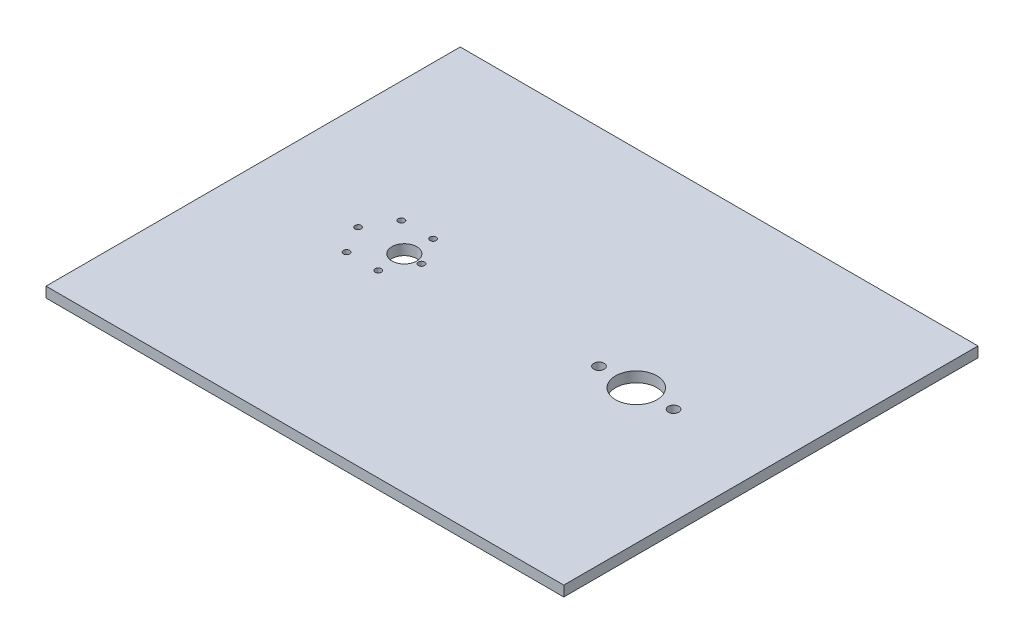
from build123d import *

# Parameters (mm, degrees)
SKETCH1_W           = 250
SKETCH1_H           = 200
SKETCH1_R           = 10
SKETCH1_R_2         = 2.5
SKETCH1_R_3         = 1.5
SKETCH1_R_4         = 6
BOSS_EXTRUDE1_DEPTH = 5


with BuildPart() as part:
    # Sketch1 → Boss-Extrude1 (new body)
    with BuildSketch(Plane(origin=(0, 0, 0), x_dir=(1, 0, 0), z_dir=(0, 1, 0))):
        Rectangle(SKETCH1_W, SKETCH1_H)
        with Locations(Location((60, 0, 0), (0, 0, 270))):
            Circle(SKETCH1_R, mode=Mode.SUBTRACT)
        with Locations(Location((78, 0, 0), (0, 0, 270))):
            Circle(SKETCH1_R_2, mode=Mode.SUBTRACT)
        with Locations(Location((42, 0, 0), (0, 0, 270))):
            Circle(SKETCH1_R_2, mode=Mode.SUBTRACT)
        with Locations(Location((-43.7, 0, 0), (0, 0, 270))):
            Circle(SKETCH1_R_3, mode=Mode.SUBTRACT)
        with Locations(Location((-51.35, -13.250188678, 0), (0, 0, 270))):
            Circle(SKETCH1_R_3, mode=Mode.SUBTRACT)
        with Locations(Location((-66.65, -13.250188678, 0), (0, 0, 270))):
            Circle(SKETCH1_R_3, mode=Mode.SUBTRACT)
        with Locations(Location((-74.3, 0, 0), (0, 0, 270))):
            Circle(SKETCH1_R_3, mode=Mode.SUBTRACT)
        with Locations(Location((-66.65, 13.250188678, 0), (0, 0, 270))):
            Circle(SKETCH1_R_3, mode=Mode.SUBTRACT)
        with Locations(Location((-51.35, 13.250188678, 0), (0, 0, 270))):
            Circle(SKETCH1_R_3, mode=Mode.SUBTRACT)
        with Locations(Location((-52, 0, 0), (0, 0, 270))):
            Circle(SKETCH1_R_4, mode=Mode.SUBTRACT)
    extrude(amount=BOSS_EXTRUDE1_DEPTH)


solid = part.part
